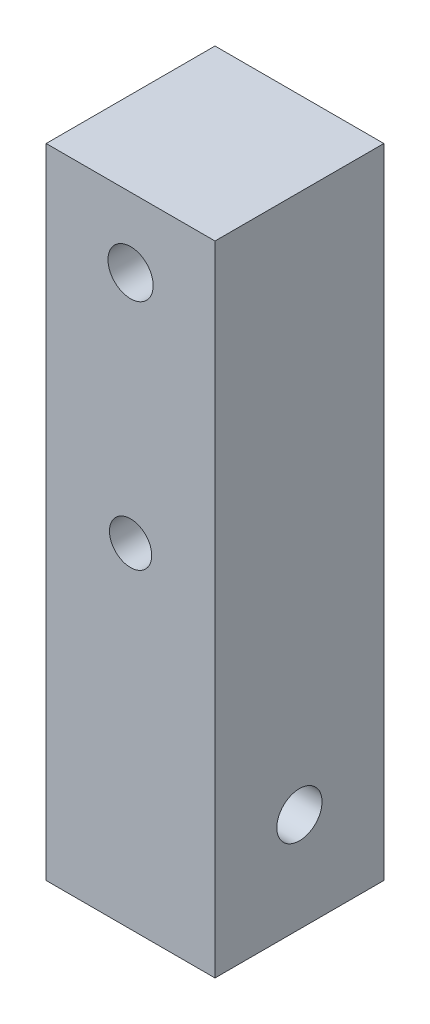
from build123d import *

# Parameters (mm, degrees)
SKETCH1_W           = 12.7
SKETCH1_H           = 12.7
BOSS_EXTRUDE1_DEPTH = 48.006
SKETCH2_R           = 1.5875
CUT_EXTRUDE1_DEPTH  = 51.061847109
SKETCH3_R           = 1.7
CUT_EXTRUDE2_DEPTH  = 51.061847109
SKETCH4_R           = 1.7
CUT_EXTRUDE3_DEPTH  = 51.061847109


with BuildPart() as part:
    # Sketch1 → Boss-Extrude1 (new body)
    with BuildSketch(Plane(origin=(0, 0, 0), x_dir=(1, 0, 0), z_dir=(0, 1, 0))):
        Rectangle(SKETCH1_W, SKETCH1_H)
    extrude(amount=BOSS_EXTRUDE1_DEPTH)

    # Sketch2 → Cut-Extrude1 (cut, through all)
    with BuildSketch(Plane.XY.offset(6.35)):
        with Locations((0, 25.146)):
            Circle(SKETCH2_R)
    extrude(amount=-CUT_EXTRUDE1_DEPTH, mode=Mode.SUBTRACT)

    # Sketch3 → Cut-Extrude2 (cut, through all)
    with BuildSketch(Plane.XY.offset(6.35)):
        with Locations((0, 42.76725)):
            Circle(SKETCH3_R)
    extrude(amount=-CUT_EXTRUDE2_DEPTH, mode=Mode.SUBTRACT)

    # Sketch4 → Cut-Extrude3 (cut, through all)
    with BuildSketch(Plane(origin=(6.35, 0, 0), x_dir=(0, 0, -1), z_dir=(1, 0, 0))):
        with Locations((0, 7.46125)):
            Circle(SKETCH4_R)
    extrude(amount=-CUT_EXTRUDE3_DEPTH, mode=Mode.SUBTRACT)


solid = part.part
